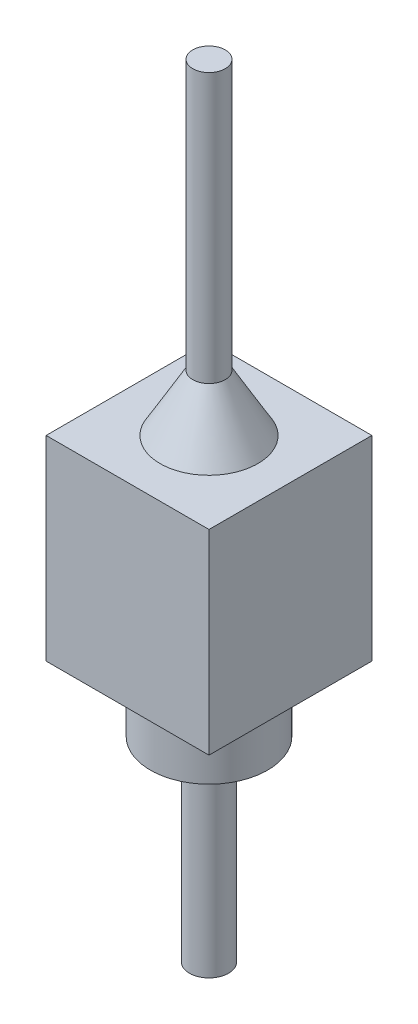
from build123d import *

# Parameters (mm, degrees)
SKETCH_1_W      = 2.5
SKETCH_1_H      = 2.5
EXTRUDE_1_DEPTH = 3
SKETCH_3_R      = 0.9
EXTRUDE_2_DEPTH = 1
SKETCH_4_R      = 0.3
EXTRUDE_3_DEPTH = 3
SKETCH_5_R      = 0.25
EXTRUDE_4_DEPTH = 5
CHAMFER_1_SIZE  = 0.5
CHAMFER_1_SIZE2 = 0.866025404


with BuildPart() as part:
    # Эскиз1 → Бобышка-Вытянуть1 (new body)
    with BuildSketch(Plane(origin=(0, 0, 0), x_dir=(1, 0, 0), z_dir=(0, 1, 0))):
        Rectangle(SKETCH_1_W, SKETCH_1_H)
    extrude(amount=EXTRUDE_1_DEPTH)

    # Эскиз3 → Бобышка-Вытянуть2 (add)
    with BuildSketch(Plane.XZ):
        with Locations(Location((0, 0, 0), (0, 0, 270))):
            Circle(SKETCH_3_R)
    extrude(amount=EXTRUDE_2_DEPTH)

    # Эскиз4 → Бобышка-Вытянуть3 (add)
    with BuildSketch(Plane.XZ.offset(1)):
        with Locations(Location((0, 0, 0), (0, 0, 270))):
            Circle(SKETCH_4_R)
    extrude(amount=EXTRUDE_3_DEPTH)

    # Эскиз5 → Бобышка-Вытянуть4 (add)
    with BuildSketch(Plane(origin=(0, 3, 0), x_dir=(1, 0, 0), z_dir=(0, 1, 0))):
        with Locations(Location((0, 0, 0), (0, 0, 90))):
            Circle(SKETCH_5_R)
    extrude(amount=EXTRUDE_4_DEPTH)

    # Фаска1
    chamfer_1_edges = [part.edges().sort_by_distance(p)[0] for p in [
        (0, 3, 0.25),
    ]]
    chamfer_1_side = [part.faces().sort_by_distance(p)[0] for p in [
        (0, 3, -1.214644661),
    ]]
    chamfer(chamfer_1_edges, length=CHAMFER_1_SIZE, length2=CHAMFER_1_SIZE2, reference=chamfer_1_side[0])


solid = part.part
